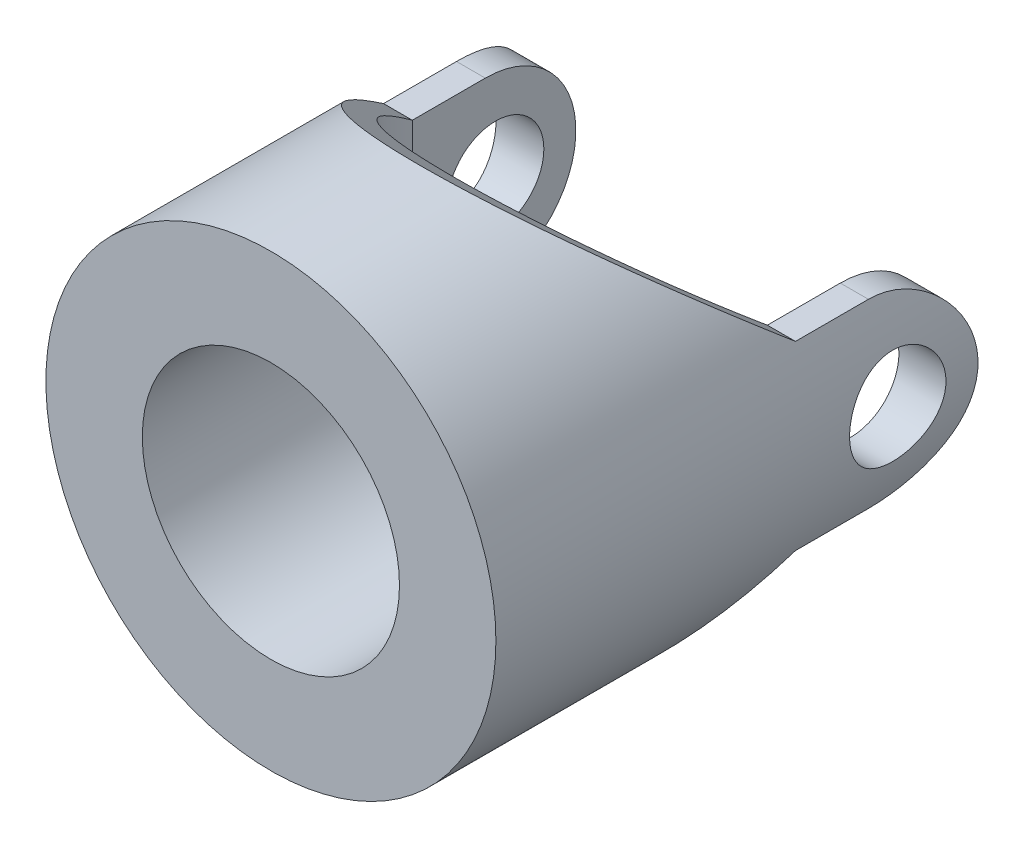
from build123d import *

# Parameters (mm, degrees)
SKETCH1_R               = 35
SKETCH1_R_2             = 20
BOSS_EXTRUDE1_DEPTH     = 75
CUT_EXTRUDE1_DEPTH      = 45
CUT_EXTRUDE1_DEPTH_BACK = 54
CUT_EXTRUDE2_DEPTH      = 48
CUT_EXTRUDE2_DEPTH_BACK = 44
CUT_EXTRUDE3_DEPTH      = 44
CUT_EXTRUDE3_DEPTH_BACK = 44
SKETCH4_R               = 7.5


with BuildPart() as part:
    # Sketch1 → Boss-Extrude1 (new body)
    with BuildSketch(Plane.XY):
        Circle(SKETCH1_R)
        Circle(SKETCH1_R_2, mode=Mode.SUBTRACT)
    extrude(amount=BOSS_EXTRUDE1_DEPTH)

    # Sketch2 → Cut-Extrude1 (cut, two sides: drawn at the far end of the back side and taken through both)
    with BuildSketch(Plane(origin=(0, 0, 0), x_dir=(0, 0, -1), z_dir=(1, 0, 0)).offset(-CUT_EXTRUDE1_DEPTH_BACK)):
        with BuildLine():
            Line((0, -35), (0, 0))
            ThreePointArc((0, 0), (-4.127707746, -9.965168023), (-14.092875769, -14.092875769))
            Line((-14.092875769, -14.092875769), (-25.439318665, -14.092875769))
            Line((-25.439318665, -14.092875769), (-52.150222161, -35))
            Line((-52.150222161, -35), (0, -35))
        make_face()
        with BuildLine():
            Line((-25.439318665, 14.092875769), (-14.092875769, 14.092875769))
            ThreePointArc((-14.092875769, 14.092875769), (-4.127707746, 9.965168023), (0, 0))
            Line((0, 0), (0, 35))
            Line((0, 35), (-51.84345844, 35))
            Line((-51.84345844, 35), (-25.439318665, 14.092875769))
        make_face()
    extrude(amount=CUT_EXTRUDE1_DEPTH + CUT_EXTRUDE1_DEPTH_BACK, mode=Mode.SUBTRACT)

    # Sketch3 → Cut-Extrude2 (cut, two sides: drawn at the far end of the back side and taken through both)
    with BuildSketch(Plane(origin=(0, 0, 0), x_dir=(1, 0, 0), z_dir=(0, 1, 0)).offset(-CUT_EXTRUDE2_DEPTH_BACK)):
        with BuildLine():
            Line((-27.558791769, 0), (-27.558791769, -25.439318665))
            ThreePointArc((-27.558791769, -25.439318665), (0.052095226, -46.7551788), (27.662982221, -25.439318665))
            Line((27.662982221, -25.439318665), (27.662982221, 0))
            Line((27.662982221, 0), (-27.558791769, 0))
        make_face()
    extrude(amount=CUT_EXTRUDE2_DEPTH + CUT_EXTRUDE2_DEPTH_BACK, mode=Mode.SUBTRACT)

    # Sketch4 → Cut-Extrude3 (cut, two sides: drawn at the far end of the back side and taken through both)
    with BuildSketch(Plane(origin=(0, 0, 0), x_dir=(0, 0, -1), z_dir=(1, 0, 0)).offset(-CUT_EXTRUDE3_DEPTH_BACK)):
        with Locations(Location((-12.483344887, 0, 0), (0, 0, 180))):
            Circle(SKETCH4_R)
    extrude(amount=CUT_EXTRUDE3_DEPTH + CUT_EXTRUDE3_DEPTH_BACK, mode=Mode.SUBTRACT)


solid = part.part
